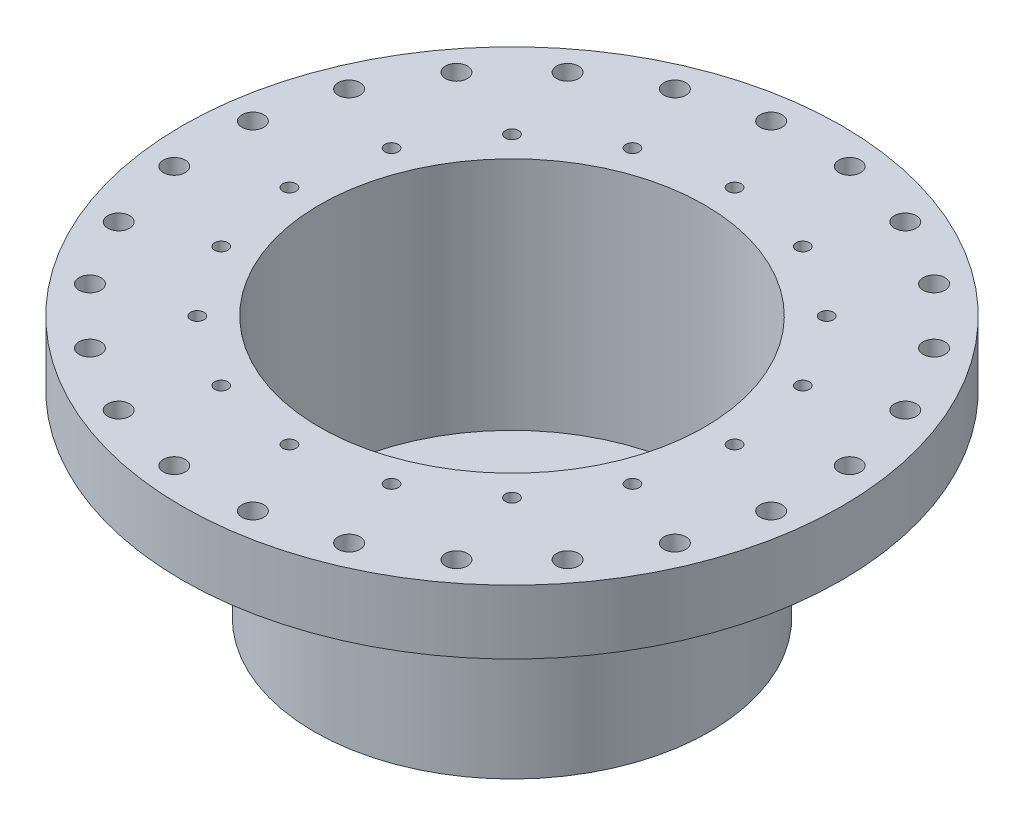
from build123d import *

# Parameters (mm, degrees)
SKETCH1_R               = 76.2
EXTRUDE1_DEPTH          = 75.946
SKETCH2_R               = 127
EXTRUDE2_DEPTH          = 24.638
CUT_EXTRUDE1_DEPTH      = 196.002038236
CUT_EXTRUDE1_DEPTH_BACK = 65.9384
SKETCH3_R               = 74.168
SKETCH4_R               = 50.8
CUT_EXTRUDE2_DEPTH      = 196.002038236
CIRPATTERN2_COUNT       = 16
SKETCH5_R               = 4.2164
CUT_EXTRUDE5_DEPTH      = 196.002038236
CIRPATTERN3_COUNT       = 24


with BuildPart() as part:
    # Sketch1 → Extrude1 (new body)
    with BuildSketch(Plane(origin=(0, 0, 0), x_dir=(1, 0, 0), z_dir=(0, 1, 0))):
        with Locations(Location((0, 0, 0), (0, 0, 270))):
            Circle(SKETCH1_R)
    extrude(amount=-EXTRUDE1_DEPTH)

    # Sketch2 → Extrude2 (add)
    with BuildSketch(Plane(origin=(0, 0, 0), x_dir=(1, 0, 0), z_dir=(0, 1, 0))):
        with Locations(Location((0, 0, 0), (0, 0, 90))):
            Circle(SKETCH2_R)
    extrude(amount=EXTRUDE2_DEPTH)

    # Sketch3 → Cut-Extrude1 (cut, two sides: drawn at the far end of the back side and taken through both)
    with BuildSketch(Plane(origin=(0, 0, 0), x_dir=(1, 0, 0), z_dir=(0, 1, 0)).offset(-CUT_EXTRUDE1_DEPTH_BACK)):
        with Locations(Location((0, 0, 0), (0, 0, 90))):
            Circle(SKETCH3_R)
    extrude(amount=CUT_EXTRUDE1_DEPTH + CUT_EXTRUDE1_DEPTH_BACK, mode=Mode.SUBTRACT)

    # Sketch4 → Cut-Extrude2 (cut, through all)
    with BuildSketch(Plane(origin=(0, 0, 0), x_dir=(1, 0, 0), z_dir=(0, 1, 0))):
        with Locations(Location((0, 0, 0), (0, 0, 270))):
            Circle(SKETCH4_R)
    extrude(amount=-CUT_EXTRUDE2_DEPTH, mode=Mode.SUBTRACT)

    # Sketch11 → 1/4-20 Tapped Hole1 (revolve, cut)
    with BuildSketch(Plane(origin=(0, 24.638, -85.725), x_dir=(0, 0, 1), z_dir=(1, 0, 0))):
        Polygon((0, 0), (0, 18.043816902), (2.5527, 16.51), (2.5527, 0), align=None)
    f_1_4_20_tapped_hole1 = revolve(axis=Axis((0, 30.988, -85.725), (0, -1, 0)), mode=Mode.SUBTRACT)

    # CirPattern2: 1/4-20 Tapped Hole1 ×16 about axis
    cirpattern2_axis = Axis((0, 0, 0), (0, 1, 0))
    for i in range(1, CIRPATTERN2_COUNT):
        add(f_1_4_20_tapped_hole1.rotate(cirpattern2_axis, i * 360 / CIRPATTERN2_COUNT), mode=Mode.SUBTRACT)

    # Sketch5 → Cut-Extrude5 (cut, through all)
    with BuildSketch(Plane(origin=(0, 0, 0), x_dir=(1, 0, 0), z_dir=(0, 1, 0))):
        with Locations(Location((-15.134642514, 114.959023121, 0), (0, 0, 90))):
            Circle(SKETCH5_R)
    cut_extrude5 = extrude(amount=CUT_EXTRUDE5_DEPTH, mode=Mode.SUBTRACT)

    # CirPattern3: Cut-Extrude5 ×24 about axis
    cirpattern3_axis = Axis((0, 0, 0), (0, 1, 0))
    for i in range(1, CIRPATTERN3_COUNT):
        add(cut_extrude5.rotate(cirpattern3_axis, i * 360 / CIRPATTERN3_COUNT), mode=Mode.SUBTRACT)


solid = part.part
